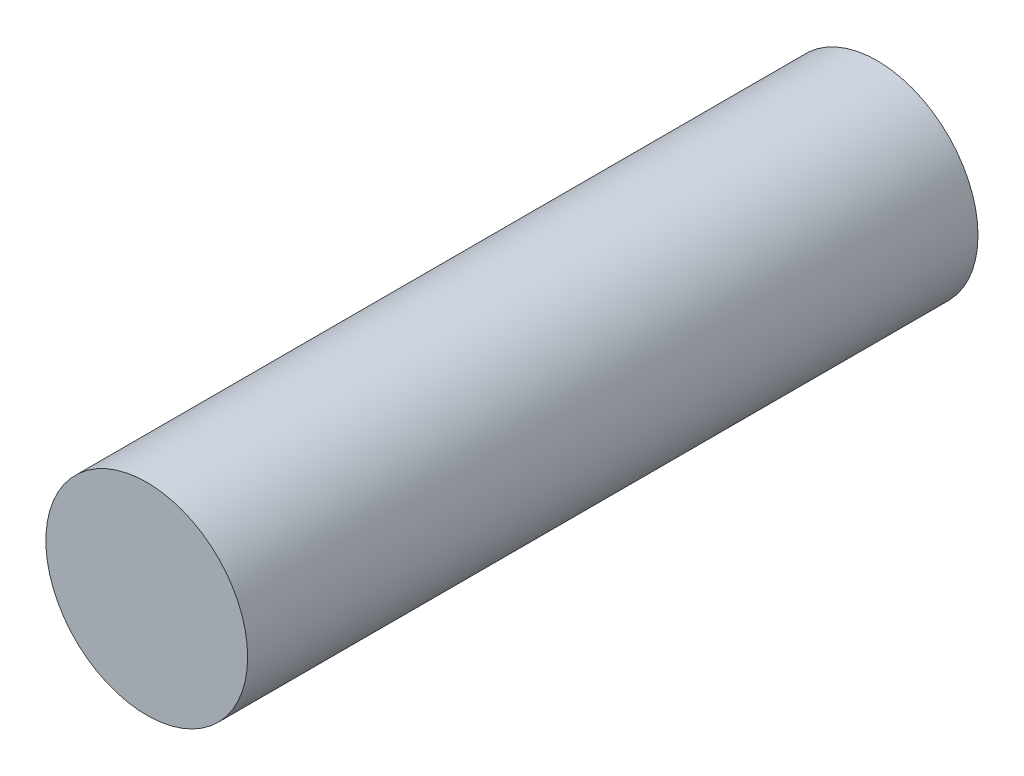
from build123d import *

# Parameters (mm, degrees)
SKETCH_1_R      = 52.5
EXTRUDE_1_DEPTH = 380


with BuildPart() as part:
    # 草图1 → 凸台-拉伸1 (new body)
    with BuildSketch(Plane.XY):
        Circle(SKETCH_1_R)
    extrude(amount=EXTRUDE_1_DEPTH)


solid = part.part
